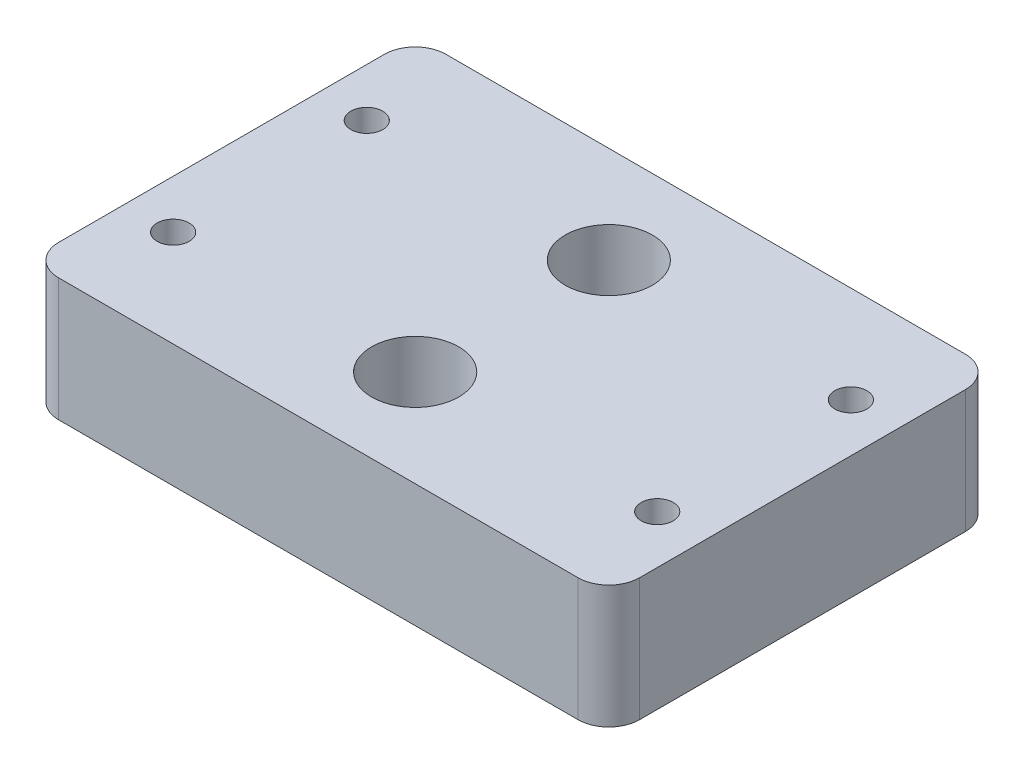
from build123d import *

# Parameters (mm, degrees)
SKETCH1_W           = 60
SKETCH1_H           = 40
SKETCH1_R           = 4.5
SKETCH1_R_2         = 1.651
BOSS_EXTRUDE1_DEPTH = 12.7
FILLET1_R           = 3.175


with BuildPart() as part:
    # Sketch1 → Boss-Extrude1 (new body)
    with BuildSketch(Plane(origin=(0, 0, 0), x_dir=(1, 0, 0), z_dir=(0, 1, 0))):
        with Locations((30, -20)):
            Rectangle(SKETCH1_W, SKETCH1_H)
        with Locations(Location((30, -30, 0), (0, 0, 270))):
            Circle(SKETCH1_R, mode=Mode.SUBTRACT)
        with Locations(Location((30, -10, 0), (0, 0, 270))):
            Circle(SKETCH1_R, mode=Mode.SUBTRACT)
        with Locations(Location((5, -10, 0), (0, 0, 270))):
            Circle(SKETCH1_R_2, mode=Mode.SUBTRACT)
        with Locations(Location((55, -10, 0), (0, 0, 270))):
            Circle(SKETCH1_R_2, mode=Mode.SUBTRACT)
        with Locations(Location((5, -30, 0), (0, 0, 270))):
            Circle(SKETCH1_R_2, mode=Mode.SUBTRACT)
        with Locations(Location((55, -30, 0), (0, 0, 270))):
            Circle(SKETCH1_R_2, mode=Mode.SUBTRACT)
    extrude(amount=BOSS_EXTRUDE1_DEPTH)

    # Fillet1
    fillet1_edges = [part.edges().sort_by_distance(p)[0] for p in [
        (60, 6.35, 40),
        (0, 6.35, 40),
        (0, 6.35, 0),
        (60, 6.35, 0),
    ]]
    fillet(fillet1_edges, radius=FILLET1_R)


solid = part.part
